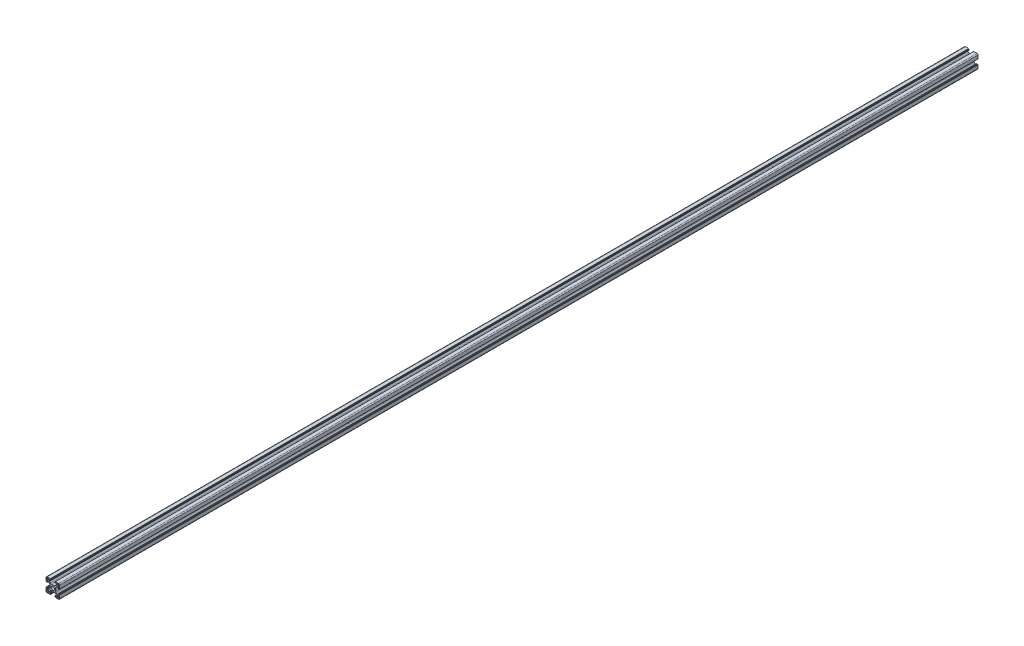
from build123d import *

# Parameters (mm, degrees)
EXTRUDE_1_DEPTH = 1350


with BuildPart() as part:
    # Эскиз1 → Бобышка-Вытянуть1 (new body)
    with BuildSketch(Plane.XY):
        with BuildLine():
            Line((0.259458272, 4.035699369), (2.158238941, 4.035699369))
            ThreePointArc((2.158238941, 4.035699369), (2.923605806, 4.187940304), (3.572452504, 4.621485807))
            Line((3.572452504, 4.621485807), (4.873671834, 5.922705138))
            ThreePointArc((4.873671834, 5.922705138), (5.307217337, 6.571551836), (5.459458272, 7.3369187))
            Line((5.459458272, 7.3369187), (5.459458272, 8.235699369))
            ThreePointArc((5.459458272, 8.235699369), (5.313011663, 8.58925276), (4.959458272, 8.735699369))
            Line((4.959458272, 8.735699369), (4.856565053, 8.735699369))
            ThreePointArc((4.856565053, 8.735699369), (4.665223337, 8.697639136), (4.503011663, 8.58925276))
            Line((4.503011663, 8.58925276), (4.022681577, 8.108922674))
            ThreePointArc((4.022681577, 8.108922674), (3.94157574, 8.054729486), (3.845904882, 8.035699369))
            Line((3.845904882, 8.035699369), (3.559458272, 8.035699369))
            ThreePointArc((3.559458272, 8.035699369), (3.382681577, 8.108922674), (3.309458272, 8.285699369))
            Line((3.309458272, 8.285699369), (3.309458272, 9.43477019))
            ThreePointArc((3.309458272, 9.43477019), (3.353392255, 9.540836207), (3.459458272, 9.58477019))
            Line((3.459458272, 9.58477019), (3.959458272, 9.58477019))
            Line((3.959458272, 9.58477019), (3.959458272, 9.885699369))
            ThreePointArc((3.959458272, 9.885699369), (4.003392255, 9.991765387), (4.109458272, 10.035699369))
            Line((4.109458272, 10.035699369), (8.759458272, 10.035699369))
            ThreePointArc((8.759458272, 10.035699369), (9.820118444, 9.596359541), (10.259458272, 8.535699369))
            Line((10.259458272, 8.535699369), (10.259458272, 3.885699369))
            ThreePointArc((10.259458272, 3.885699369), (10.215524289, 3.779633352), (10.109458272, 3.735699369))
            Line((10.109458272, 3.735699369), (9.808529093, 3.735699369))
            Line((9.808529093, 3.735699369), (9.808529093, 3.235699369))
            ThreePointArc((9.808529093, 3.235699369), (9.76459511, 3.129633352), (9.658529093, 3.085699369))
            Line((9.658529093, 3.085699369), (8.509458272, 3.085699369))
            ThreePointArc((8.509458272, 3.085699369), (8.332681577, 3.158922674), (8.259458272, 3.335699369))
            Line((8.259458272, 3.335699369), (8.259458272, 3.622145979))
            ThreePointArc((8.259458272, 3.622145979), (8.278488389, 3.717816837), (8.332681577, 3.798922674))
            Line((8.332681577, 3.798922674), (8.813011663, 4.27925276))
            ThreePointArc((8.813011663, 4.27925276), (8.921398038, 4.441464434), (8.959458272, 4.632806151))
            Line((8.959458272, 4.632806151), (8.959458272, 4.735699369))
            ThreePointArc((8.959458272, 4.735699369), (8.813011663, 5.08925276), (8.459458272, 5.235699369))
            Line((8.459458272, 5.235699369), (7.560677603, 5.235699369))
            ThreePointArc((7.560677603, 5.235699369), (6.795310738, 5.083458434), (6.146464041, 4.649912932))
            Line((6.146464041, 4.649912932), (4.84524471, 3.348693601))
            ThreePointArc((4.84524471, 3.348693601), (4.411699207, 2.699846903), (4.259458272, 1.934480039))
            Line((4.259458272, 1.934480039), (4.259458272, 0.035699369))
            Line((4.259458272, 0.035699369), (4.259458272, -1.8630813))
            ThreePointArc((4.259458272, -1.8630813), (4.411699207, -2.628448164), (4.84524471, -3.277294862))
            Line((4.84524471, -3.277294862), (6.146464041, -4.578514193))
            ThreePointArc((6.146464041, -4.578514193), (6.795310738, -5.012059696), (7.560677603, -5.164300631))
            Line((7.560677603, -5.164300631), (8.459458272, -5.164300631))
            ThreePointArc((8.459458272, -5.164300631), (8.813011663, -5.017854021), (8.959458272, -4.664300631))
            Line((8.959458272, -4.664300631), (8.959458272, -4.561407412))
            ThreePointArc((8.959458272, -4.561407412), (8.921398038, -4.370065696), (8.813011663, -4.207854021))
            Line((8.813011663, -4.207854021), (8.332681577, -3.727523935))
            ThreePointArc((8.332681577, -3.727523935), (8.278488389, -3.646418098), (8.259458272, -3.55074724))
            Line((8.259458272, -3.55074724), (8.259458272, -3.264300631))
            ThreePointArc((8.259458272, -3.264300631), (8.332681577, -3.087523935), (8.509458272, -3.014300631))
            Line((8.509458272, -3.014300631), (9.658529093, -3.014300631))
            ThreePointArc((9.658529093, -3.014300631), (9.76459511, -3.058234613), (9.808529093, -3.164300631))
            Line((9.808529093, -3.164300631), (9.808529093, -3.664300631))
            Line((9.808529093, -3.664300631), (10.109458272, -3.664300631))
            ThreePointArc((10.109458272, -3.664300631), (10.215524289, -3.708234613), (10.259458272, -3.814300631))
            Line((10.259458272, -3.814300631), (10.259458272, -8.464300631))
            ThreePointArc((10.259458272, -8.464300631), (9.820118444, -9.524960802), (8.759458272, -9.964300631))
            Line((8.759458272, -9.964300631), (4.109458272, -9.964300631))
            ThreePointArc((4.109458272, -9.964300631), (4.003392255, -9.920366648), (3.959458272, -9.814300631))
            Line((3.959458272, -9.814300631), (3.959458272, -9.513371451))
            Line((3.959458272, -9.513371451), (3.459458272, -9.513371451))
            ThreePointArc((3.459458272, -9.513371451), (3.353392255, -9.469437468), (3.309458272, -9.363371451))
            Line((3.309458272, -9.363371451), (3.309458272, -8.214300631))
            ThreePointArc((3.309458272, -8.214300631), (3.382681577, -8.037523935), (3.559458272, -7.964300631))
            Line((3.559458272, -7.964300631), (3.845904882, -7.964300631))
            ThreePointArc((3.845904882, -7.964300631), (3.94157574, -7.983330747), (4.022681577, -8.037523935))
            Line((4.022681577, -8.037523935), (4.503011663, -8.517854021))
            ThreePointArc((4.503011663, -8.517854021), (4.665223337, -8.626240397), (4.856565053, -8.664300631))
            Line((4.856565053, -8.664300631), (4.959458272, -8.664300631))
            ThreePointArc((4.959458272, -8.664300631), (5.313011663, -8.517854021), (5.459458272, -8.164300631))
            Line((5.459458272, -8.164300631), (5.459458272, -7.265519961))
            ThreePointArc((5.459458272, -7.265519961), (5.307217337, -6.500153097), (4.873671834, -5.851306399))
            Line((4.873671834, -5.851306399), (3.572452504, -4.550087068))
            ThreePointArc((3.572452504, -4.550087068), (2.923605806, -4.116541566), (2.158238941, -3.964300631))
            Line((2.158238941, -3.964300631), (0.259458272, -3.964300631))
            Line((0.259458272, -3.964300631), (-1.639322397, -3.964300631))
            ThreePointArc((-1.639322397, -3.964300631), (-2.404689262, -4.116541566), (-3.053535959, -4.550087068))
            Line((-3.053535959, -4.550087068), (-4.35475529, -5.851306399))
            ThreePointArc((-4.35475529, -5.851306399), (-4.788300793, -6.500153097), (-4.940541728, -7.265519961))
            Line((-4.940541728, -7.265519961), (-4.940541728, -8.164300631))
            ThreePointArc((-4.940541728, -8.164300631), (-4.794095118, -8.517854021), (-4.440541728, -8.664300631))
            Line((-4.440541728, -8.664300631), (-4.337648509, -8.664300631))
            ThreePointArc((-4.337648509, -8.664300631), (-4.146306793, -8.626240397), (-3.984095118, -8.517854021))
            Line((-3.984095118, -8.517854021), (-3.503765033, -8.037523935))
            ThreePointArc((-3.503765033, -8.037523935), (-3.422659195, -7.983330747), (-3.326988337, -7.964300631))
            Line((-3.326988337, -7.964300631), (-3.040541728, -7.964300631))
            ThreePointArc((-3.040541728, -7.964300631), (-2.863765033, -8.037523935), (-2.790541728, -8.214300631))
            Line((-2.790541728, -8.214300631), (-2.790541728, -9.363371451))
            ThreePointArc((-2.790541728, -9.363371451), (-2.834475711, -9.469437468), (-2.940541728, -9.513371451))
            Line((-2.940541728, -9.513371451), (-3.440541728, -9.513371451))
            Line((-3.440541728, -9.513371451), (-3.440541728, -9.814300631))
            ThreePointArc((-3.440541728, -9.814300631), (-3.484475711, -9.920366648), (-3.590541728, -9.964300631))
            Line((-3.590541728, -9.964300631), (-8.240541728, -9.964300631))
            ThreePointArc((-8.240541728, -9.964300631), (-9.3012019, -9.524960802), (-9.740541728, -8.464300631))
            Line((-9.740541728, -8.464300631), (-9.740541728, -3.814300631))
            ThreePointArc((-9.740541728, -3.814300631), (-9.696607745, -3.708234613), (-9.590541728, -3.664300631))
            Line((-9.590541728, -3.664300631), (-9.289612548, -3.664300631))
            Line((-9.289612548, -3.664300631), (-9.289612548, -3.164300631))
            ThreePointArc((-9.289612548, -3.164300631), (-9.245678566, -3.058234613), (-9.139612548, -3.014300631))
            Line((-9.139612548, -3.014300631), (-7.990541728, -3.014300631))
            ThreePointArc((-7.990541728, -3.014300631), (-7.813765033, -3.087523935), (-7.740541728, -3.264300631))
            Line((-7.740541728, -3.264300631), (-7.740541728, -3.55074724))
            ThreePointArc((-7.740541728, -3.55074724), (-7.759571845, -3.646418098), (-7.813765033, -3.727523935))
            Line((-7.813765033, -3.727523935), (-8.294095118, -4.207854021))
            ThreePointArc((-8.294095118, -4.207854021), (-8.402481494, -4.370065696), (-8.440541728, -4.561407412))
            Line((-8.440541728, -4.561407412), (-8.440541728, -4.664300631))
            ThreePointArc((-8.440541728, -4.664300631), (-8.294095118, -5.017854021), (-7.940541728, -5.164300631))
            Line((-7.940541728, -5.164300631), (-7.041761059, -5.164300631))
            ThreePointArc((-7.041761059, -5.164300631), (-6.276394194, -5.012059696), (-5.627547496, -4.578514193))
            Line((-5.627547496, -4.578514193), (-4.326328166, -3.277294862))
            ThreePointArc((-4.326328166, -3.277294862), (-3.892782663, -2.628448164), (-3.740541728, -1.8630813))
            Line((-3.740541728, -1.8630813), (-3.740541728, 0.035699369))
            Line((-3.740541728, 0.035699369), (-3.740541728, 1.934480039))
            ThreePointArc((-3.740541728, 1.934480039), (-3.892782663, 2.699846903), (-4.326328166, 3.348693601))
            Line((-4.326328166, 3.348693601), (-5.627547496, 4.649912932))
            ThreePointArc((-5.627547496, 4.649912932), (-6.276394194, 5.083458434), (-7.041761059, 5.235699369))
            Line((-7.041761059, 5.235699369), (-7.940541728, 5.235699369))
            ThreePointArc((-7.940541728, 5.235699369), (-8.294095118, 5.08925276), (-8.440541728, 4.735699369))
            Line((-8.440541728, 4.735699369), (-8.440541728, 4.632806151))
            ThreePointArc((-8.440541728, 4.632806151), (-8.402481494, 4.441464434), (-8.294095118, 4.27925276))
            Line((-8.294095118, 4.27925276), (-7.813765033, 3.798922674))
            ThreePointArc((-7.813765033, 3.798922674), (-7.759571845, 3.717816837), (-7.740541728, 3.622145979))
            Line((-7.740541728, 3.622145979), (-7.740541728, 3.335699369))
            ThreePointArc((-7.740541728, 3.335699369), (-7.813765033, 3.158922674), (-7.990541728, 3.085699369))
            Line((-7.990541728, 3.085699369), (-9.139612548, 3.085699369))
            ThreePointArc((-9.139612548, 3.085699369), (-9.245678566, 3.129633352), (-9.289612548, 3.235699369))
            Line((-9.289612548, 3.235699369), (-9.289612548, 3.735699369))
            Line((-9.289612548, 3.735699369), (-9.590541728, 3.735699369))
            ThreePointArc((-9.590541728, 3.735699369), (-9.696607745, 3.779633352), (-9.740541728, 3.885699369))
            Line((-9.740541728, 3.885699369), (-9.740541728, 8.535699369))
            ThreePointArc((-9.740541728, 8.535699369), (-9.3012019, 9.596359541), (-8.240541728, 10.035699369))
            Line((-8.240541728, 10.035699369), (-3.590541728, 10.035699369))
            ThreePointArc((-3.590541728, 10.035699369), (-3.484475711, 9.991765387), (-3.440541728, 9.885699369))
            Line((-3.440541728, 9.885699369), (-3.440541728, 9.58477019))
            Line((-3.440541728, 9.58477019), (-2.940541728, 9.58477019))
            ThreePointArc((-2.940541728, 9.58477019), (-2.834475711, 9.540836207), (-2.790541728, 9.43477019))
            Line((-2.790541728, 9.43477019), (-2.790541728, 8.285699369))
            ThreePointArc((-2.790541728, 8.285699369), (-2.863765033, 8.108922674), (-3.040541728, 8.035699369))
            Line((-3.040541728, 8.035699369), (-3.326988337, 8.035699369))
            ThreePointArc((-3.326988337, 8.035699369), (-3.422659195, 8.054729486), (-3.503765033, 8.108922674))
            Line((-3.503765033, 8.108922674), (-3.984095118, 8.58925276))
            ThreePointArc((-3.984095118, 8.58925276), (-4.146306793, 8.697639136), (-4.337648509, 8.735699369))
            Line((-4.337648509, 8.735699369), (-4.440541728, 8.735699369))
            ThreePointArc((-4.440541728, 8.735699369), (-4.794095118, 8.58925276), (-4.940541728, 8.235699369))
            Line((-4.940541728, 8.235699369), (-4.940541728, 7.3369187))
            ThreePointArc((-4.940541728, 7.3369187), (-4.788300793, 6.571551836), (-4.35475529, 5.922705138))
            Line((-4.35475529, 5.922705138), (-3.053535959, 4.621485807))
            ThreePointArc((-3.053535959, 4.621485807), (-2.404689262, 4.187940304), (-1.639322397, 4.035699369))
            Line((-1.639322397, 4.035699369), (0.259458272, 4.035699369))
        make_face()
        with BuildLine():
            Line((7.159458272, 6.135699369), (8.559458272, 6.135699369))
            ThreePointArc((8.559458272, 6.135699369), (9.125143697, 6.370013944), (9.359458272, 6.935699369))
            Line((9.359458272, 6.935699369), (9.359458272, 8.335699369))
            ThreePointArc((9.359458272, 8.335699369), (9.125143697, 8.901384794), (8.559458272, 9.135699369))
            Line((8.559458272, 9.135699369), (7.159458272, 9.135699369))
            ThreePointArc((7.159458272, 9.135699369), (6.593772847, 8.901384794), (6.359458272, 8.335699369))
            Line((6.359458272, 8.335699369), (6.359458272, 6.935699369))
            ThreePointArc((6.359458272, 6.935699369), (6.593772847, 6.370013944), (7.159458272, 6.135699369))
        make_face(mode=Mode.SUBTRACT)
        with BuildLine():
            Line((6.359458272, -6.864300631), (6.359458272, -8.264300631))
            ThreePointArc((6.359458272, -8.264300631), (6.593772847, -8.829986056), (7.159458272, -9.064300631))
            Line((7.159458272, -9.064300631), (8.559458272, -9.064300631))
            ThreePointArc((8.559458272, -9.064300631), (9.125143697, -8.829986056), (9.359458272, -8.264300631))
            Line((9.359458272, -8.264300631), (9.359458272, -6.864300631))
            ThreePointArc((9.359458272, -6.864300631), (9.125143697, -6.298615206), (8.559458272, -6.064300631))
            Line((8.559458272, -6.064300631), (7.159458272, -6.064300631))
            ThreePointArc((7.159458272, -6.064300631), (6.593772847, -6.298615206), (6.359458272, -6.864300631))
        make_face(mode=Mode.SUBTRACT)
        with BuildLine():
            Line((-6.640541728, -6.064300631), (-8.040541728, -6.064300631))
            ThreePointArc((-8.040541728, -6.064300631), (-8.606227153, -6.298615206), (-8.840541728, -6.864300631))
            Line((-8.840541728, -6.864300631), (-8.840541728, -8.264300631))
            ThreePointArc((-8.840541728, -8.264300631), (-8.606227153, -8.829986056), (-8.040541728, -9.064300631))
            Line((-8.040541728, -9.064300631), (-6.640541728, -9.064300631))
            ThreePointArc((-6.640541728, -9.064300631), (-6.074856303, -8.829986056), (-5.840541728, -8.264300631))
            Line((-5.840541728, -8.264300631), (-5.840541728, -6.864300631))
            ThreePointArc((-5.840541728, -6.864300631), (-6.074856303, -6.298615206), (-6.640541728, -6.064300631))
        make_face(mode=Mode.SUBTRACT)
        with BuildLine():
            Line((-5.840541728, 6.935699369), (-5.840541728, 8.335699369))
            ThreePointArc((-5.840541728, 8.335699369), (-6.074856303, 8.901384794), (-6.640541728, 9.135699369))
            Line((-6.640541728, 9.135699369), (-8.040541728, 9.135699369))
            ThreePointArc((-8.040541728, 9.135699369), (-8.606227153, 8.901384794), (-8.840541728, 8.335699369))
            Line((-8.840541728, 8.335699369), (-8.840541728, 6.935699369))
            ThreePointArc((-8.840541728, 6.935699369), (-8.606227153, 6.370013944), (-8.040541728, 6.135699369))
            Line((-8.040541728, 6.135699369), (-6.640541728, 6.135699369))
            ThreePointArc((-6.640541728, 6.135699369), (-6.074856303, 6.370013944), (-5.840541728, 6.935699369))
        make_face(mode=Mode.SUBTRACT)
        with BuildLine():
            ThreePointArc((2.759458272, 0.035699369), (2.027225225, 1.803466322), (0.259458272, 2.535699369))
            ThreePointArc((0.259458272, 2.535699369), (-1.508308681, 1.803466322), (-2.240541728, 0.035699369))
            ThreePointArc((-2.240541728, 0.035699369), (-1.508308681, -1.732067584), (0.259458272, -2.464300631))
            ThreePointArc((0.259458272, -2.464300631), (2.027225225, -1.732067584), (2.759458272, 0.035699369))
        make_face(mode=Mode.SUBTRACT)
    extrude(amount=EXTRUDE_1_DEPTH)


solid = part.part
